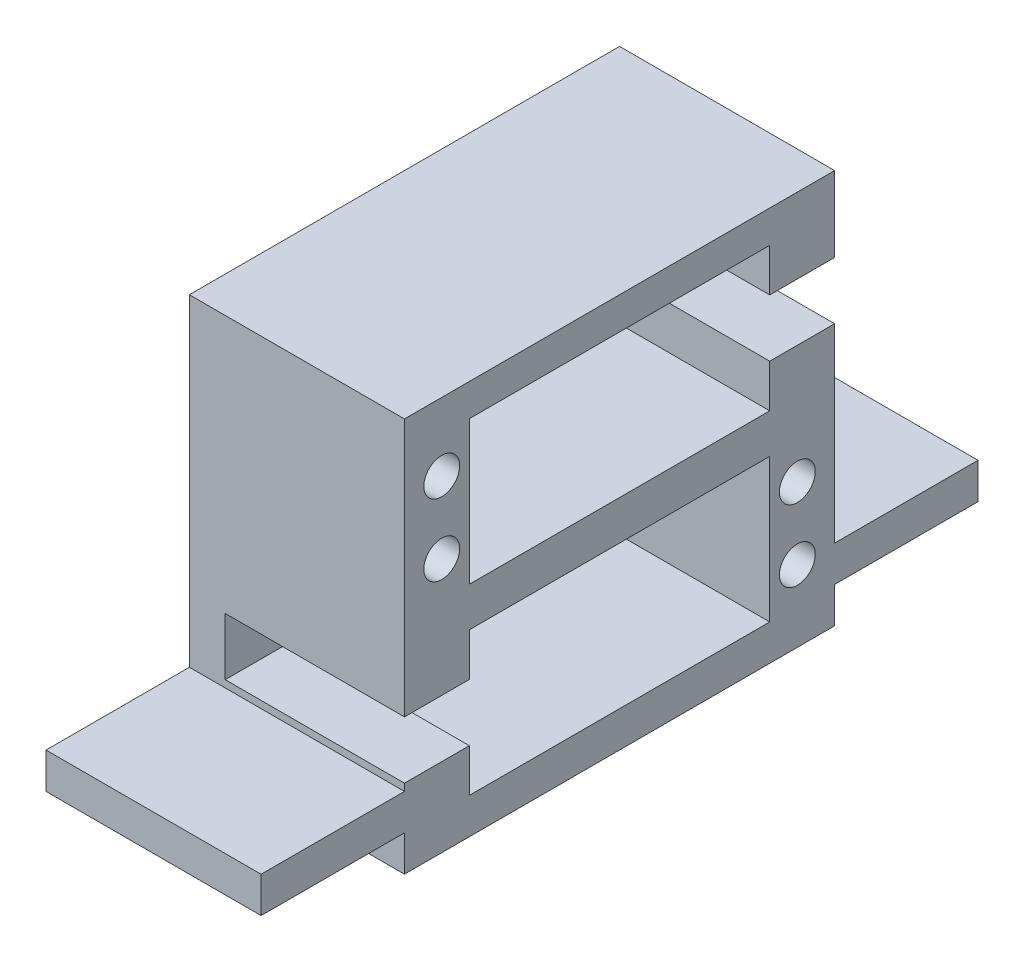
from build123d import *

# Parameters (mm, degrees)
SKETCH1_W                = 43
SKETCH1_H                = 60
BOSS_EXTRUDE1_DEPTH      = 55
SKETCH2_W                = 41.9
SKETCH2_H                = 20
CUT_EXTRUDE1_DEPTH       = 38
SKETCH3_W                = 9.05
SKETCH3_H                = 8
CUT_EXTRUDE2_DEPTH       = 38
SKETCH4_W                = 60
SKETCH4_H                = 55
CUT_EXTRUDE3_DEPTH       = 13
BOSS_EXTRUDE5_DEPTH      = 20
BOSS_EXTRUDE5_DEPTH_BACK = 80
SKETCH11_W               = 30
SKETCH11_H               = 5
SKETCH12_R               = 2.5
CUT_EXTRUDE4_DEPTH       = 10
SKETCH13_R               = 2.5
CUT_EXTRUDE5_DEPTH       = 10
SKETCH15_W               = 41.9
SKETCH15_H               = 5
CUT_EXTRUDE7_DEPTH       = 25


with BuildPart() as part:
    # Sketch1 → Boss-Extrude1 (new body)
    with BuildSketch(Plane(origin=(0, 0, 0), x_dir=(1, 0, 0), z_dir=(0, 1, 0))):
        with Locations((20.625984252, 7.362204724)):
            Rectangle(SKETCH1_W, SKETCH1_H)
    extrude(amount=BOSS_EXTRUDE1_DEPTH)

    # Sketch2 → Cut-Extrude1 (cut)
    with BuildSketch(Plane(origin=(42.125984252, 0, 0), x_dir=(0, 0, -1), z_dir=(1, 0, 0))):
        with Locations((7.362204724, 40.5)):
            Rectangle(SKETCH2_W, SKETCH2_H)
        with Locations((7.362204724, 15)):
            Rectangle(SKETCH2_W, SKETCH2_H)
    extrude(amount=-CUT_EXTRUDE1_DEPTH, mode=Mode.SUBTRACT)

    # Sketch3 → Cut-Extrude2 (cut)
    with BuildSketch(Plane(origin=(42.125984252, 0, 0), x_dir=(0, 0, -1), z_dir=(1, 0, 0))):
        with Locations((-18.112795276, 15)):
            Rectangle(SKETCH3_W, SKETCH3_H)
        with Locations((32.837204724, 40.5)):
            Rectangle(SKETCH3_W, SKETCH3_H)
    extrude(amount=-CUT_EXTRUDE2_DEPTH, mode=Mode.SUBTRACT)

    # Sketch4 → Cut-Extrude3 (cut)
    with BuildSketch(Plane(origin=(42.125984252, 0, 0), x_dir=(0, 0, -1), z_dir=(1, 0, 0))):
        with Locations((7.362204724, 27.5)):
            Rectangle(SKETCH4_W, SKETCH4_H)
    extrude(amount=-CUT_EXTRUDE3_DEPTH, mode=Mode.SUBTRACT)

    # Sketch11 → Boss-Extrude5 (add, two sides: drawn at the far end of the back side and taken through both)
    with BuildSketch(Plane.XY.offset(22.637795276).offset(-BOSS_EXTRUDE5_DEPTH_BACK)):
        with Locations((14.125984252, 7.5)):
            Rectangle(SKETCH11_W, SKETCH11_H)
    extrude(amount=BOSS_EXTRUDE5_DEPTH + BOSS_EXTRUDE5_DEPTH_BACK)

    # Sketch12 → Cut-Extrude4 (cut)
    with BuildSketch(Plane(origin=(29.125984252, 0, 0), x_dir=(0, 0, -1), z_dir=(1, 0, 0))):
        with Locations((-17.437795276, 45.5)):
            Circle(SKETCH12_R)
        with Locations((-17.437795276, 35.5)):
            Circle(SKETCH12_R)
    extrude(amount=-CUT_EXTRUDE4_DEPTH, mode=Mode.SUBTRACT)

    # Sketch13 → Cut-Extrude5 (cut)
    with BuildSketch(Plane(origin=(29.125984252, 0, 0), x_dir=(0, 0, -1), z_dir=(1, 0, 0))):
        with Locations((32.162204724, 20)):
            Circle(SKETCH13_R)
        with Locations((32.162204724, 10)):
            Circle(SKETCH13_R)
    extrude(amount=-CUT_EXTRUDE5_DEPTH, mode=Mode.SUBTRACT)

    # Sketch15 → Cut-Extrude7 (cut)
    with BuildSketch(Plane(origin=(29.125984252, 0, 0), x_dir=(0, 0, -1), z_dir=(1, 0, 0))):
        with Locations((7.362204724, 7.5)):
            Rectangle(SKETCH15_W, SKETCH15_H)
    extrude(amount=-CUT_EXTRUDE7_DEPTH, mode=Mode.SUBTRACT)


solid = part.part
